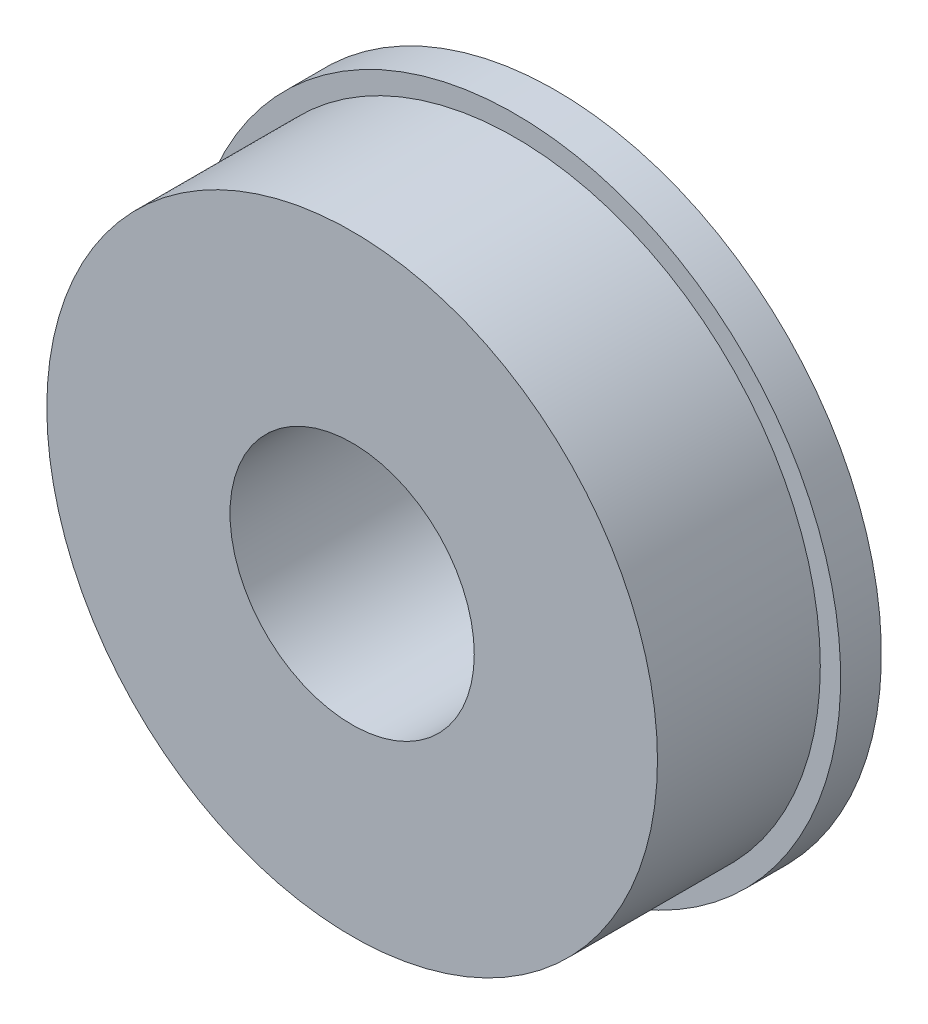
from build123d import *

# Parameters (mm, degrees)
SKETCH1_R           = 7.5
SKETCH1_R_2         = 3
BOSS_EXTRUDE1_DEPTH = 5
SKETCH2_R           = 8
SKETCH2_R_2         = 7.5
BOSS_EXTRUDE2_DEPTH = 1


with BuildPart() as part:
    # Sketch1 → Boss-Extrude1 (new body)
    with BuildSketch(Plane.XY):
        Circle(SKETCH1_R)
        Circle(SKETCH1_R_2, mode=Mode.SUBTRACT)
    extrude(amount=BOSS_EXTRUDE1_DEPTH)

    # Sketch2 → Boss-Extrude2 (add)
    with BuildSketch(Plane(origin=(0, 0, 0), x_dir=(-1, 0, 0), z_dir=(0, 0, -1))):
        Circle(SKETCH2_R)
        Circle(SKETCH2_R_2, mode=Mode.SUBTRACT)
    extrude(amount=-BOSS_EXTRUDE2_DEPTH)


solid = part.part
